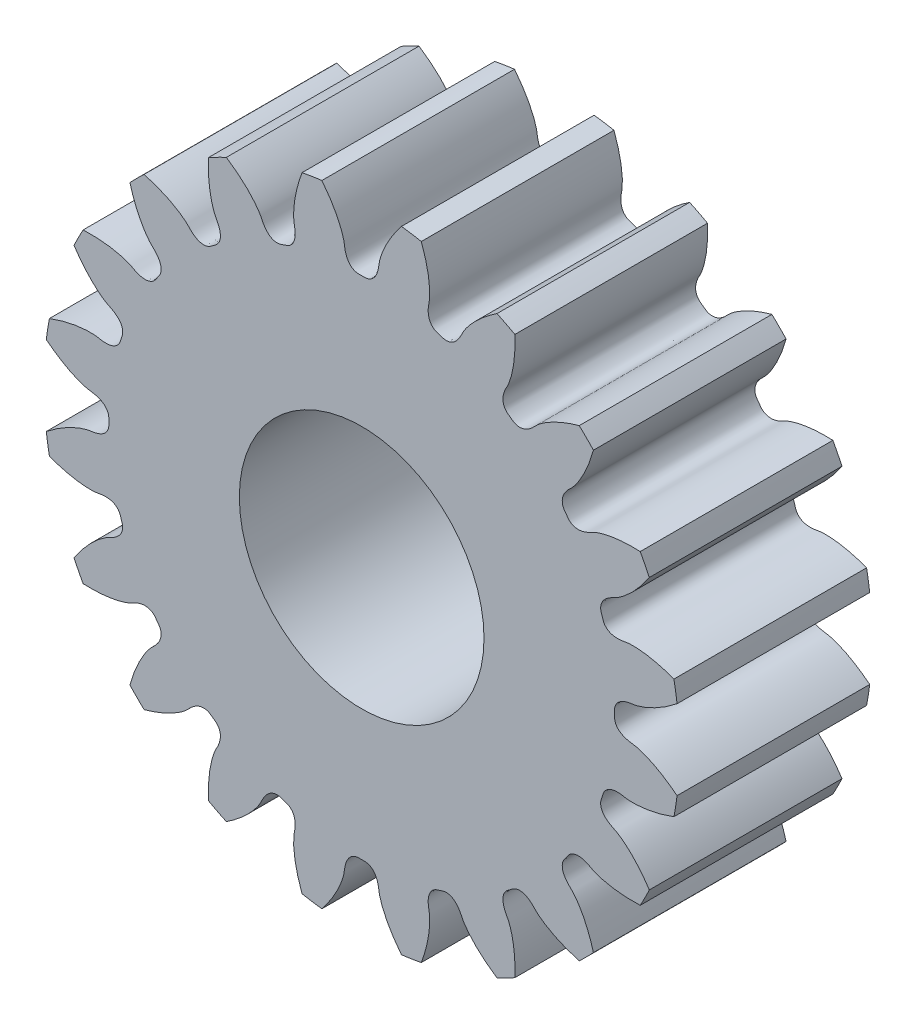
from build123d import *

# Parameters (mm, degrees)
SKETCHREVOLVESPURASSEMBLY01PINION_W       = 10
SKETCHREVOLVESPURASSEMBLY01PINION_H       = 16.499999752
TOOTHEXTRUDECUTSPURASSEMBLY01PINION_DEPTH = 5
PATTERNSPURASSEMBLY01PINION_COUNT         = 20
BOREREVOLVESKETCH_W                       = 10
BOREREVOLVESKETCH_H                       = 6.349999905


with BuildPart() as part:
    # SketchRevolveSpurAssembly01Pinion → SpurAssembly01Pinion (revolve)
    with BuildSketch(Plane(origin=(0, 0, 0), x_dir=(0, 0, -1), z_dir=(1, 0, 0))):
        with Locations((0, 8.249999876)):
            Rectangle(SKETCHREVOLVESPURASSEMBLY01PINION_W, SKETCHREVOLVESPURASSEMBLY01PINION_H)
    revolve(axis=Axis((0, 0, 0), (0, 0, -1)))

    # SketchToothSpurAssembly01Pinion → ToothExtrudeCutSpurAssembly01Pinion (cut, symmetric)
    with BuildSketch(Plane.XY):
        with BuildLine():
            ThreePointArc((16.438815928, 2.120364973), (16.574999751, 0), (16.438815928, -2.120364973))
            add(Edge.make_bspline(
                [(16.438815928, -2.120364973), (16.306213447, -2.012632117), (16.10792267, -1.860929635), (15.841705586, -1.676668952), (15.654853966, -1.55570694), (15.475899367, -1.447553762), (15.305444286, -1.351598726), (15.144060802, -1.267206194), (14.992289617, -1.193717223), (14.850639167, -1.130450865), (14.719584807, -1.0767054), (14.599567969, -1.031760257), (14.490995634, -0.99487577), (14.394239041, -0.965299916), (14.309634999, -0.942253529), (14.237479548, -0.924980687), (14.178044201, -0.912608864), (14.049223501, -0.890261122), (13.912281496, -0.878231728), (13.769652297, -0.842658369), (13.695599357, -0.820644128), (13.624377747, -0.794966749), (13.555692175, -0.765356143), (13.489258635, -0.731124882), (13.424830796, -0.691333031), (13.362331646, -0.644635632), (13.30209452, -0.589245233), (13.24524803, -0.523019137), (13.194309632, -0.443877425), (13.153279262, -0.350864326), (13.130262908, -0.253354669), (13.120821868, -0.134969136), (13.12767395, 0), (13.120821868, 0.134969136), (13.130262908, 0.253354669), (13.153279262, 0.350864326), (13.194309632, 0.443877425), (13.24524803, 0.523019137), (13.30209452, 0.589245233), (13.362331646, 0.644635632), (13.424830796, 0.691333031), (13.489258635, 0.731124882), (13.555692175, 0.765356143), (13.624377747, 0.794966749), (13.695599357, 0.820644128), (13.769652297, 0.842658369), (13.912281496, 0.878231728), (14.049223501, 0.890261122), (14.178044201, 0.912608864), (14.237479548, 0.924980687), (14.309634999, 0.942253529), (14.394239041, 0.965299916), (14.490995634, 0.99487577), (14.599567969, 1.031760257), (14.719584807, 1.0767054), (14.850639167, 1.130450865), (14.992289617, 1.193717223), (15.144060802, 1.267206194), (15.305444286, 1.351598726), (15.475899367, 1.447553762), (15.654853966, 1.55570694), (15.841705586, 1.676668952), (16.10792267, 1.860929635), (16.306213447, 2.012632117), (16.438815928, 2.120364973)],
                knots=[0, 0, 0, 0, 0.061422842, 0.089709677, 0.116380121, 0.141434175, 0.164871838, 0.186693111, 0.206897994, 0.225486485, 0.242458587, 0.257814298, 0.271553618, 0.283676548, 0.294183087, 0.303073236, 0.310346995, 0.316004363, 0.350076802, 0.359567688, 0.36880314, 0.37784437, 0.386769007, 0.395675631, 0.404688756, 0.413962948, 0.423682731, 0.434051196, 0.445255861, 0.457401439, 0.47041984, 0.481066796, 0.5, 0.518933204, 0.52958016, 0.542598561, 0.554744139, 0.565948804, 0.576317269, 0.586037052, 0.595311244, 0.604324369, 0.613230993, 0.62215563, 0.63119686, 0.640432312, 0.649923198, 0.683995637, 0.689653005, 0.696926764, 0.705816913, 0.716323452, 0.728446382, 0.742185702, 0.757541413, 0.774513515, 0.793102006, 0.813306889, 0.835128162, 0.858565825, 0.883619879, 0.910290323, 0.938577158, 1, 1, 1, 1], degree=3))
        make_face()
    toothextrudecutspurassembly01pinion = extrude(amount=TOOTHEXTRUDECUTSPURASSEMBLY01PINION_DEPTH, both=True, mode=Mode.SUBTRACT)

    # PatternSpurAssembly01Pinion: ToothExtrudeCutSpurAssembly01Pinion ×20 about axis
    patternspurassembly01pinion_axis = Axis((0, 0, 55), (0, 0, -1))
    for i in range(1, PATTERNSPURASSEMBLY01PINION_COUNT):
        add(toothextrudecutspurassembly01pinion.rotate(patternspurassembly01pinion_axis, i * 360 / PATTERNSPURASSEMBLY01PINION_COUNT), mode=Mode.SUBTRACT)

    # BoreRevolveSketch → BoreRevolveCut (revolve, cut)
    with BuildSketch(Plane(origin=(0, 0, 0), x_dir=(0, 0, -1), z_dir=(1, 0, 0))):
        with Locations((0, 3.174999953)):
            Rectangle(BOREREVOLVESKETCH_W, BOREREVOLVESKETCH_H)
    revolve(axis=Axis((0, 0, 0), (0, 0, -1)), mode=Mode.SUBTRACT)


solid = part.part
